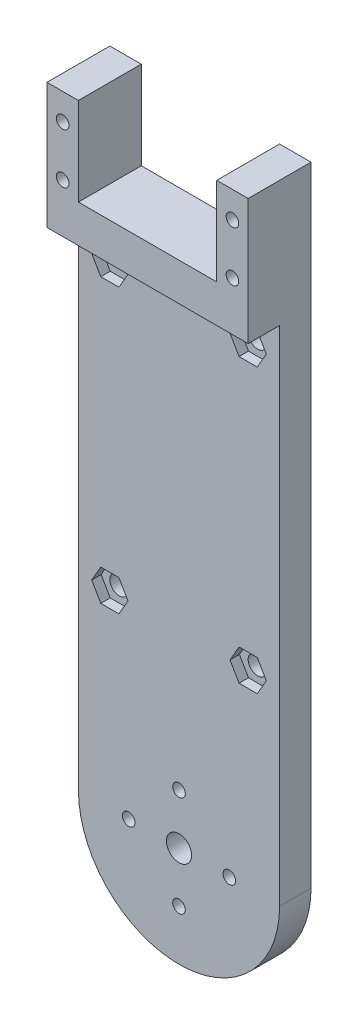
from build123d import *

# Parameters (mm, degrees)
SKETCH1_R           = 1
SKETCH1_R_2         = 2
SKETCH1_R_3         = 1.5
BOSS_EXTRUDE1_DEPTH = 5
SKETCH3_R           = 1
BOSS_EXTRUDE2_DEPTH = 10
CUT_EXTRUDE1_DEPTH  = 1.5


with BuildPart() as part:
    # Sketch1 → Boss-Extrude1 (new body)
    with BuildSketch(Plane.XY):
        with BuildLine():
            Line((-16, 0), (-16, 80))
            Line((-16, 80), (16, 80))
            Line((16, 80), (16, 0))
            ThreePointArc((16, 0), (0, -16), (-16, 0))
        make_face()
        with Locations((0, -8)):
            Circle(SKETCH1_R, mode=Mode.SUBTRACT)
        Circle(SKETCH1_R_2, mode=Mode.SUBTRACT)
        with Locations((-8, 0)):
            Circle(SKETCH1_R, mode=Mode.SUBTRACT)
        with Locations((0, 8)):
            Circle(SKETCH1_R, mode=Mode.SUBTRACT)
        with Locations((8, 0)):
            Circle(SKETCH1_R, mode=Mode.SUBTRACT)
        with Locations((11, 75)):
            Circle(SKETCH1_R_3, mode=Mode.SUBTRACT)
        with Locations((-11, 75)):
            Circle(SKETCH1_R_3, mode=Mode.SUBTRACT)
        with Locations((-11, 30)):
            Circle(SKETCH1_R_3, mode=Mode.SUBTRACT)
        with Locations((11, 30)):
            Circle(SKETCH1_R_3, mode=Mode.SUBTRACT)
    extrude(amount=BOSS_EXTRUDE1_DEPTH)

    # Sketch3 → Boss-Extrude2 (add)
    with BuildSketch(Plane.XY):
        Polygon((-16, 80), (16, 80), (16, 100), (11, 100), (11, 86), (-11, 86), (-11, 100), (-16, 100), align=None)
        with Locations((-13.5, 95.8)):
            Circle(SKETCH3_R, mode=Mode.SUBTRACT)
        with Locations((13.5, 95.8)):
            Circle(SKETCH3_R, mode=Mode.SUBTRACT)
        with Locations((13.5, 87.8)):
            Circle(SKETCH3_R, mode=Mode.SUBTRACT)
        with Locations((-13.5, 87.8)):
            Circle(SKETCH3_R, mode=Mode.SUBTRACT)
    extrude(amount=BOSS_EXTRUDE2_DEPTH)

    # Sketch5 → Cut-Extrude1 (cut)
    with BuildSketch(Plane.XY.offset(5)):
        Polygon((-8.113248654, 75), (-9.556624327, 77.5), (-12.443375673, 77.5), (-13.886751346, 75), (-12.443375673, 72.5), (-9.556624327, 72.5), align=None)
        Polygon((-8.113248654, 30), (-9.556624327, 32.5), (-12.443375673, 32.5), (-13.886751346, 30), (-12.443375673, 27.5), (-9.556624327, 27.5), align=None)
        Polygon((13.886751346, 30), (12.443375673, 32.5), (9.556624327, 32.5), (8.113248654, 30), (9.556624327, 27.5), (12.443375673, 27.5), align=None)
        Polygon((13.886751346, 75), (12.443375673, 77.5), (9.556624327, 77.5), (8.113248654, 75), (9.556624327, 72.5), (12.443375673, 72.5), align=None)
    extrude(amount=-CUT_EXTRUDE1_DEPTH, mode=Mode.SUBTRACT)


solid = part.part
